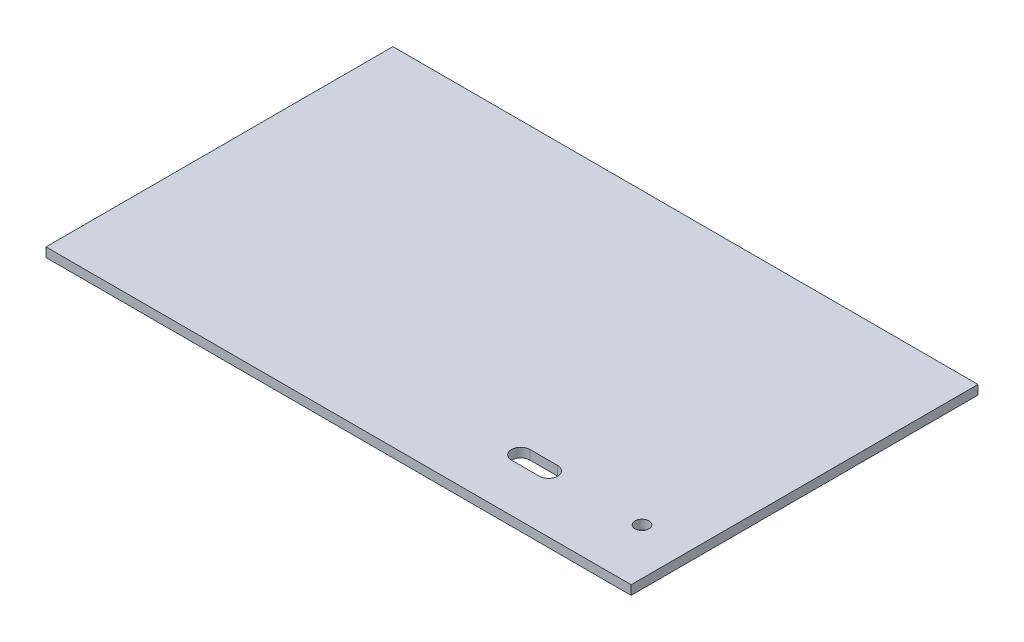
from build123d import *

# Parameters (mm, degrees)
SKETCH2_W           = 253
SKETCH2_H           = 150
BOSS_EXTRUDE1_DEPTH = 4
SKETCH3_R           = 3
CUT_EXTRUDE1_DEPTH  = 148.116450474


with BuildPart() as part:
    # Sketch2 → Boss-Extrude1 (new body)
    with BuildSketch(Plane(origin=(0, 0, 0), x_dir=(1, 0, 0), z_dir=(0, 1, 0))):
        Rectangle(SKETCH2_W, SKETCH2_H)
    extrude(amount=BOSS_EXTRUDE1_DEPTH)

    # Sketch3 → Cut-Extrude1 (cut, through all)
    with BuildSketch(Plane(origin=(0, 4, 0), x_dir=(1, 0, 0), z_dir=(0, 1, 0))):
        with Locations(Location((106.440039591, -50.227768214, 0), (0, 0, 270))):
            Circle(SKETCH3_R)
        with BuildLine():
            Line((66, -54.227768214), (54, -54.227768214))
            ThreePointArc((54, -54.227768214), (50, -50.227768214), (54, -46.227768214))
            Line((54, -46.227768214), (66, -46.227768214))
            ThreePointArc((66, -46.227768214), (70, -50.227768214), (66, -54.227768214))
        make_face()
    extrude(amount=-CUT_EXTRUDE1_DEPTH, mode=Mode.SUBTRACT)


solid = part.part
